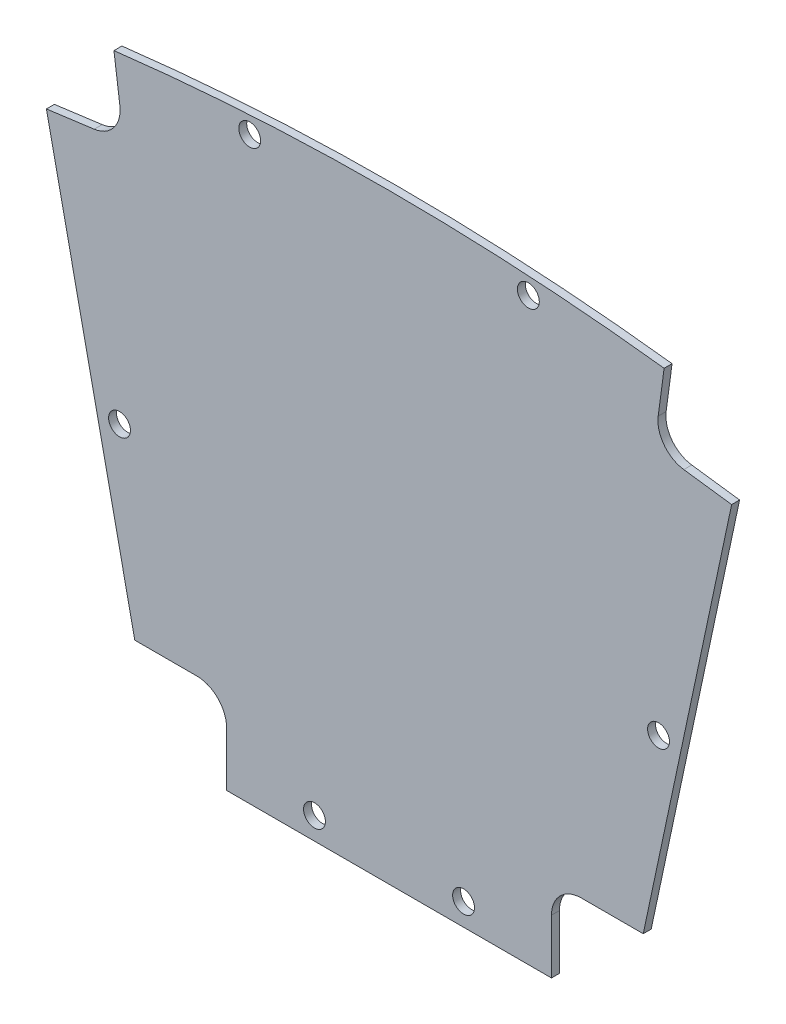
from build123d import *

# Parameters (mm, degrees)
SKETCH1_R           = 2.2
BOSS_EXTRUDE1_DEPTH = 1.6


with BuildPart() as part:
    # Sketch1 → Boss-Extrude1 (new body)
    with BuildSketch(Plane.XY):
        with BuildLine():
            Line((-55.362831431, 57.817815724), (-54.172884307, 48.873950258))
            ThreePointArc((-54.172884307, 48.873950258), (-55.355356756, 44.436600749), (-59.329170971, 42.135055108))
            Line((-59.329170971, 42.135055108), (-68.954453082, 40.854448103))
            Line((-68.954453082, 40.854448103), (-67.027453941, 31.788629925))
            Line((-67.027453941, 31.788629925), (-57.601548228, -12.556769902))
            Line((-57.601548228, -12.556769902), (-51.163468122, -42.845555417))
            Line((-51.163468122, -42.845555417), (-38.694980354, -42.845555417))
            ThreePointArc((-38.694980354, -42.845555417), (-34.452339666, -44.60291473), (-32.694980354, -48.845555417))
            Line((-32.694980354, -48.845555417), (-32.694980354, -59.794106668))
            Line((-32.694980354, -59.794106668), (-20, -59.794106668))
            Line((-20, -59.794106668), (0, -59.794106668))
            Line((0, -59.794106668), (20, -59.794106668))
            Line((20, -59.794106668), (32.694980354, -59.794106668))
            Line((32.694980354, -59.794106668), (32.694980354, -48.845555417))
            ThreePointArc((32.694980354, -48.845555417), (34.452339666, -44.60291473), (38.694980354, -42.845555417))
            Line((38.694980354, -42.845555417), (51.163468122, -42.845555417))
            Line((51.163468122, -42.845555417), (57.601548228, -12.556769902))
            Line((57.601548228, -12.556769902), (67.027453941, 31.788629925))
            Line((67.027453941, 31.788629925), (68.954453082, 40.854448103))
            Line((68.954453082, 40.854448103), (59.329170971, 42.135055108))
            ThreePointArc((59.329170971, 42.135055108), (55.355356756, 44.436600749), (54.172884307, 48.873950258))
            Line((54.172884307, 48.873950258), (55.362831431, 57.817815724))
            ThreePointArc((55.362831431, 57.817815724), (27.730985644, 60.303090258), (0, 61.132503503))
            ThreePointArc((0, 61.132503503), (-27.730985644, 60.303090258), (-55.362831431, 57.817815724))
        make_face()
        with Locations((-28.039843587, 56.853282526)):
            Circle(SKETCH1_R, mode=Mode.SUBTRACT)
        with Locations((-54.239442479, -6.730429289)):
            Circle(SKETCH1_R, mode=Mode.SUBTRACT)
        with Locations((-15, -55.294106668)):
            Circle(SKETCH1_R, mode=Mode.SUBTRACT)
        with Locations(Location((15, -55.294106668, 0), (0, 0, 180))):
            Circle(SKETCH1_R, mode=Mode.SUBTRACT)
        with Locations(Location((54.239442479, -6.730429289, 0), (0, 0, 180))):
            Circle(SKETCH1_R, mode=Mode.SUBTRACT)
        with Locations(Location((28.039843587, 56.853282526, 0), (0, 0, 180))):
            Circle(SKETCH1_R, mode=Mode.SUBTRACT)
    extrude(amount=BOSS_EXTRUDE1_DEPTH)


solid = part.part
